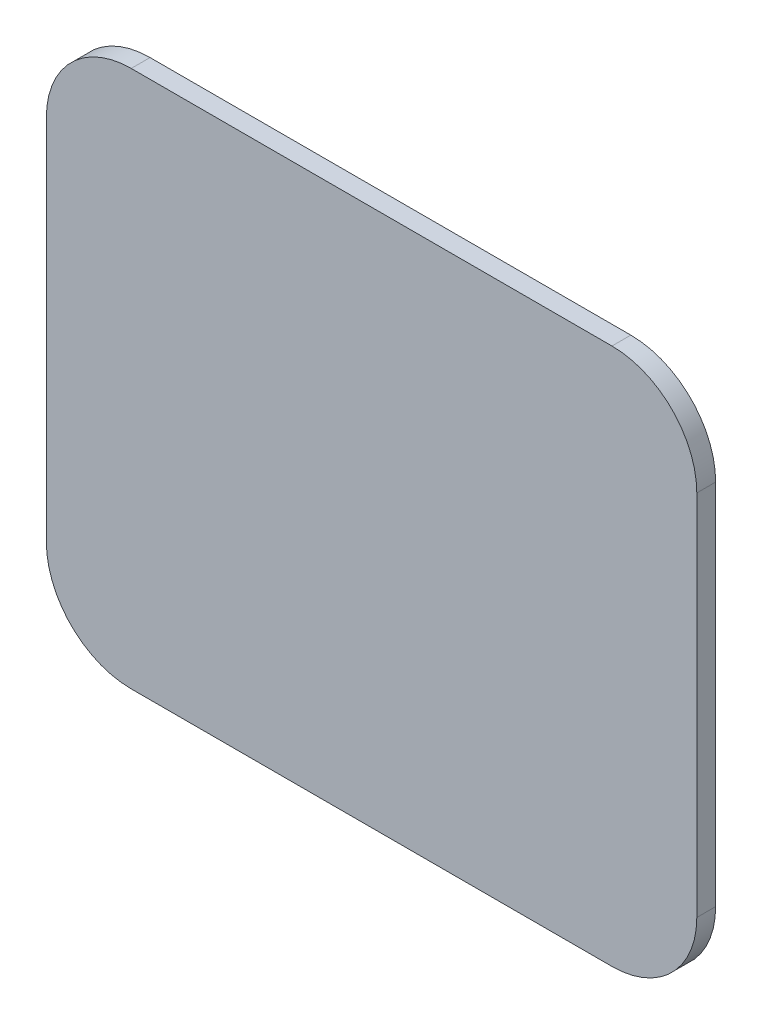
from build123d import *

# Parameters (mm, degrees)
SKETCH_1_W      = 34.5
SKETCH_1_H      = 28.5
EXTRUDE_1_DEPTH = 1
FILLET_1_R      = 4.5


with BuildPart() as part:
    # 草图1 → 凸台-拉伸1 (new body)
    with BuildSketch(Plane.XY):
        with Locations((17.25, 14.25)):
            Rectangle(SKETCH_1_W, SKETCH_1_H)
    extrude(amount=EXTRUDE_1_DEPTH)

    # 圆角1
    fillet_1_edges = [part.edges().sort_by_distance(p)[0] for p in [
        (0, 28.5, 0.5),
        (34.5, 28.5, 0.5),
        (34.5, 0, 0.5),
        (0, 0, 0.5),
    ]]
    fillet(fillet_1_edges, radius=FILLET_1_R)


solid = part.part
